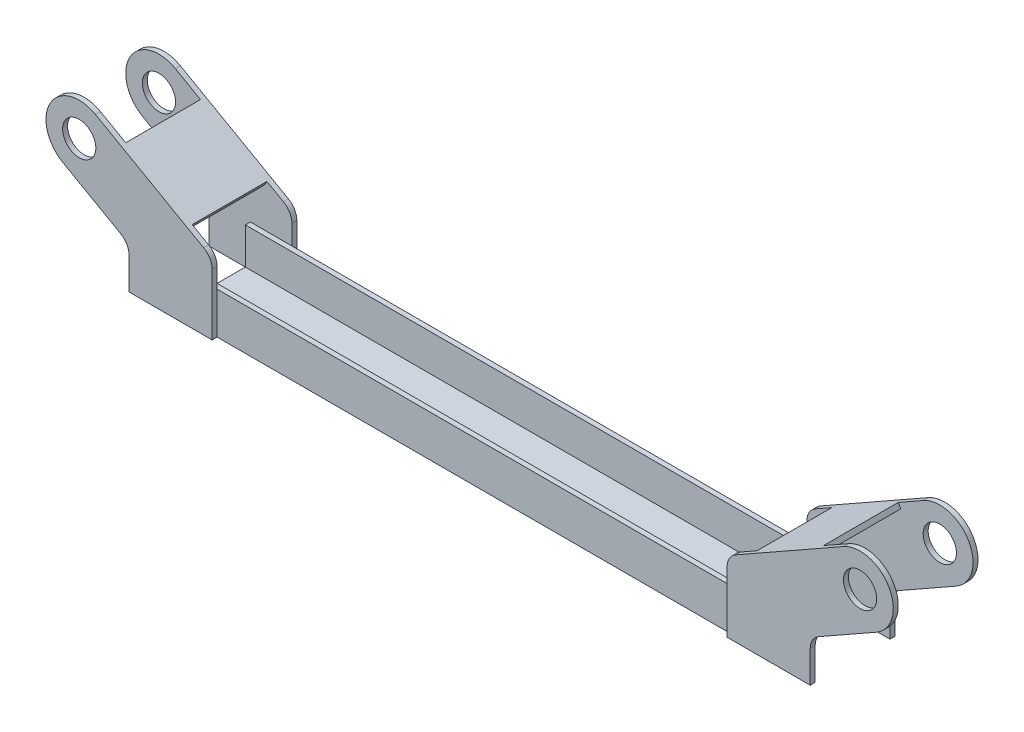
from build123d import *

# Parameters (mm, degrees)
EXTRUDE_1_DEPTH          = 180
SKETCH_2_R               = 10
EXTRUDE_2_DEPTH          = 3
EXTRUDE_3_DEPTH          = 22.5
MIRROR_2_COPY_1_SKETCH_R = 10
MIRROR_2_COPY_1_DEPTH    = 3


with BuildPart() as part:
    # 스케치1 → 보스-돌출1 (new, symmetric)
    with BuildSketch(Plane(origin=(0, 0, 0), x_dir=(0, 0, -1), z_dir=(1, 0, 0))):
        Polygon((22.5, 0), (22.5, 25), (19.5, 25), (19.5, 3), (-19.5, 3), (-19.5, 25), (-22.5, 25), (-22.5, 0), align=None)
    extrude(amount=EXTRUDE_1_DEPTH, both=True)

    # 스케치2 → 보스-돌출2 (add)
    with BuildSketch(Plane.XY.offset(22.5)):
        with BuildLine():
            Line((155, 0), (155, 36.807573628))
            ThreePointArc((155, 36.807573628), (156.359363128, 41.841398659), (160.067878888, 45.506664462))
            Line((160.067878888, 45.506664462), (225.135757776, 82.398181668))
            ThreePointArc((225.135757776, 82.398181668), (252.398181668, 74.864242224), (244.864242224, 47.601818332))
            Line((244.864242224, 47.601818332), (210.067878888, 27.873333884))
            ThreePointArc((210.067878888, 27.873333884), (206.359363128, 24.208068081), (205, 19.17424305))
            Line((205, 19.17424305), (205, 0))
            Line((205, 0), (155, 0))
        make_face()
        with Locations((235, 65)):
            Circle(SKETCH_2_R, mode=Mode.SUBTRACT)
    extrude_2 = extrude(amount=EXTRUDE_2_DEPTH)

    # 대칭 복사1: 보스-돌출2 across plane
    add(extrude_2.mirror(Plane.XY))

    # 스케치4 → 보스-돌출3 (add, symmetric)
    with BuildSketch(Plane.XY):
        Polygon((170, 51.137876408), (210, 73.816665289), (211.479636334, 71.206938039), (171.479636334, 48.528149158), align=None)
    extrude_3 = extrude(amount=EXTRUDE_3_DEPTH, both=True)

    # 대칭 복사2: 보스-돌출2, 보스-돌출3 across plane
    add(extrude_2.mirror(Plane(origin=(0, 0, 0), x_dir=(0, 0, 1), z_dir=(1, 0, 0))))
    add(extrude_3.mirror(Plane(origin=(0, 0, 0), x_dir=(0, 0, 1), z_dir=(1, 0, 0))))

    # 대칭 복사2 copy 1 sketch → 대칭 복사2 copy 1 (add)
    with BuildSketch(Plane(origin=(0, 0, -22.5), x_dir=(-1, 0, 0), z_dir=(0, 0, -1))):
        with BuildLine():
            Line((155, 0), (155, 36.807573628))
            ThreePointArc((155, 36.807573628), (156.359363128, 41.841398659), (160.067878888, 45.506664462))
            Line((160.067878888, 45.506664462), (225.135757776, 82.398181668))
            ThreePointArc((225.135757776, 82.398181668), (252.398181668, 74.864242224), (244.864242224, 47.601818332))
            Line((244.864242224, 47.601818332), (210.067878888, 27.873333884))
            ThreePointArc((210.067878888, 27.873333884), (206.359363128, 24.208068081), (205, 19.17424305))
            Line((205, 19.17424305), (205, 0))
            Line((205, 0), (155, 0))
        make_face()
        with Locations((235, 65)):
            Circle(MIRROR_2_COPY_1_SKETCH_R, mode=Mode.SUBTRACT)
    extrude(amount=MIRROR_2_COPY_1_DEPTH)


solid = part.part
